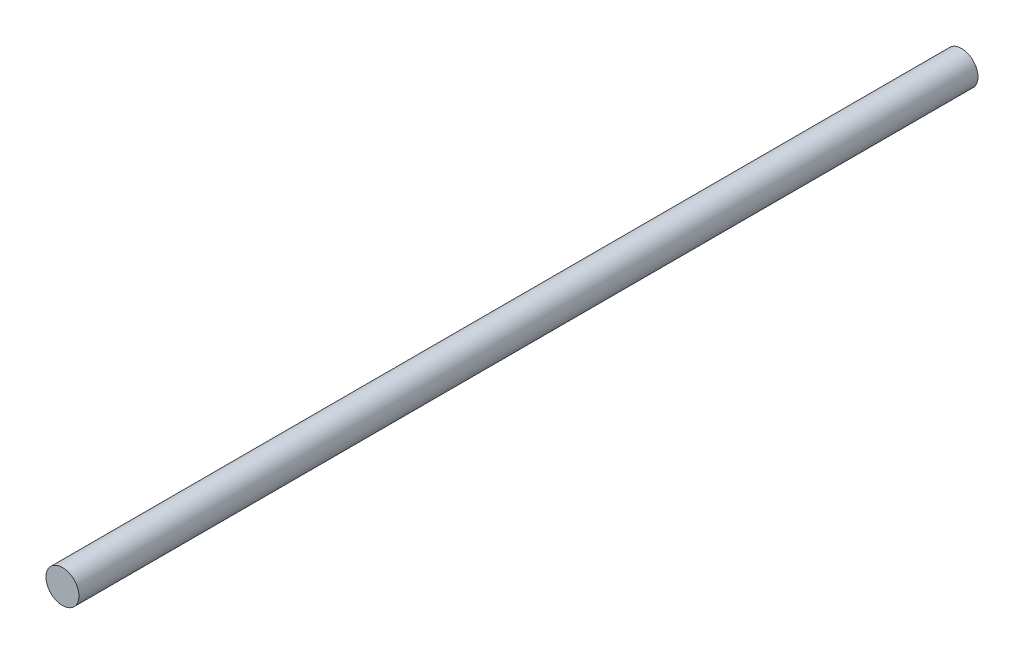
from build123d import *

# Parameters (mm, degrees)
SKETCH_1_R      = 2.75
EXTRUDE_1_DEPTH = 150


with BuildPart() as part:
    # ｽｹｯﾁ1 → ﾎﾞｽ - 押し出し1 (new body)
    with BuildSketch(Plane.XY):
        Circle(SKETCH_1_R)
    extrude(amount=EXTRUDE_1_DEPTH)


solid = part.part
